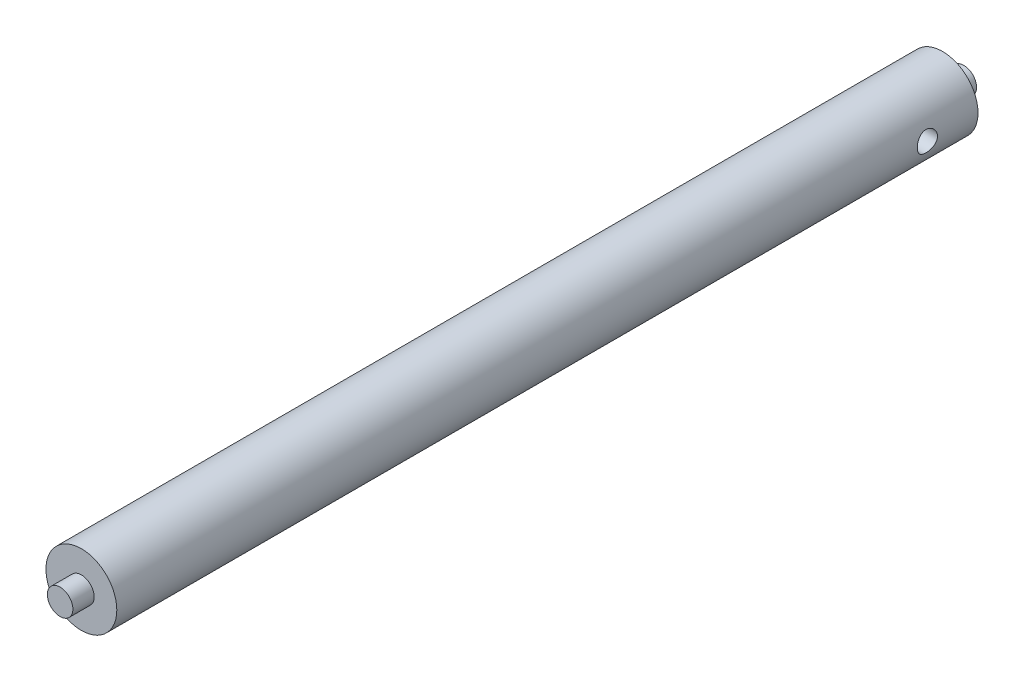
from build123d import *

# Parameters (mm, degrees)
ESQUISSE1_R                  = 50
BOSS_EXTRU_1_DEPTH           = 1215
ESQUISSE2_R                  = 18
BOSS_EXTRU_2_DEPTH           = 30
BOSS_EXTRU_3_START           = 30
ESQUISSE3_R                  = 18
BOSS_EXTRU_3_DEPTH           = 30
ENL_V_MAT_EXTRU_1_DEPTH      = 1248.00641538
ENL_V_MAT_EXTRU_1_DEPTH_BACK = 1248.00641538
ESQUISSE6_R                  = 14.3


with BuildPart() as part:
    # Esquisse1 → Boss.-Extru.1 (new body)
    with BuildSketch(Plane.XY):
        Circle(ESQUISSE1_R)
    extrude(amount=BOSS_EXTRU_1_DEPTH)

    # Esquisse2 → Boss.-Extru.2 (add)
    with BuildSketch(Plane(origin=(0, 0, 0), x_dir=(-1, 0, 0), z_dir=(0, 0, -1))):
        Circle(ESQUISSE2_R)
    extrude(amount=BOSS_EXTRU_2_DEPTH)

    # Esquisse3 → Boss.-Extru.3 (add)
    with BuildSketch(Plane.XY.offset(1215).offset(BOSS_EXTRU_3_START)):
        with Locations(Location((0, 0, 0), (0, 0, 180))):
            Circle(ESQUISSE3_R)
    extrude(amount=-BOSS_EXTRU_3_DEPTH)

    # Esquisse6 → Enlèv. mat.-Extru.1 (cut, two sides: drawn at the far end of the back side and taken through both)
    with BuildSketch(Plane(origin=(0, 0, 0), x_dir=(0, 0, -1), z_dir=(1, 0, 0)).offset(-ENL_V_MAT_EXTRU_1_DEPTH_BACK)):
        with Locations((-71.4, 0)):
            Circle(ESQUISSE6_R)
    extrude(amount=ENL_V_MAT_EXTRU_1_DEPTH + ENL_V_MAT_EXTRU_1_DEPTH_BACK, mode=Mode.SUBTRACT)


solid = part.part
